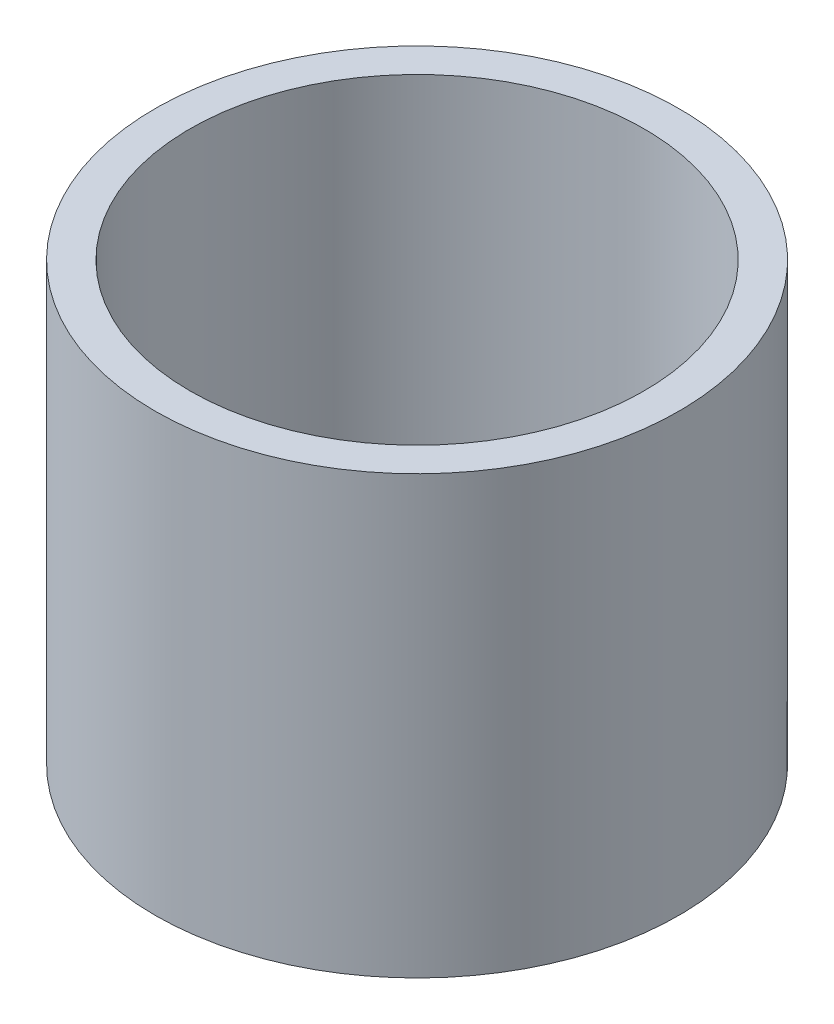
from build123d import *

# Parameters (mm, degrees)
SKETCH3_R           = 15
BOSS_EXTRUDE1_DEPTH = 25
SKETCH4_R           = 13
CUT_EXTRUDE1_DEPTH  = 22
SKETCH5_R           = 2.5
CUT_EXTRUDE2_DEPTH  = 22


with BuildPart() as part:
    # Sketch3 → Boss-Extrude1 (new body)
    with BuildSketch(Plane(origin=(0, 0, 0), x_dir=(1, 0, 0), z_dir=(0, 1, 0))):
        with Locations(Location((0, 0, 0), (0, 0, 270))):
            Circle(SKETCH3_R)
    extrude(amount=BOSS_EXTRUDE1_DEPTH)

    # Sketch4 → Cut-Extrude1 (cut)
    with BuildSketch(Plane(origin=(0, 25, 0), x_dir=(1, 0, 0), z_dir=(0, 1, 0))):
        with Locations(Location((0, 0, 0), (0, 0, 270))):
            Circle(SKETCH4_R)
    extrude(amount=-CUT_EXTRUDE1_DEPTH, mode=Mode.SUBTRACT)

    # Sketch5 → Cut-Extrude2 (cut)
    with BuildSketch(Plane(origin=(0, 3, 0), x_dir=(1, 0, 0), z_dir=(0, 1, 0))):
        with Locations(Location((10, 0, 0), (0, 0, 270))):
            Circle(SKETCH5_R)
        with Locations(Location((0, -10, 0), (0, 0, 270))):
            Circle(SKETCH5_R)
        with Locations(Location((-10, 0, 0), (0, 0, 270))):
            Circle(SKETCH5_R)
        with Locations(Location((0, 10, 0), (0, 0, 270))):
            Circle(SKETCH5_R)
    extrude(amount=-CUT_EXTRUDE2_DEPTH, mode=Mode.SUBTRACT)


solid = part.part
